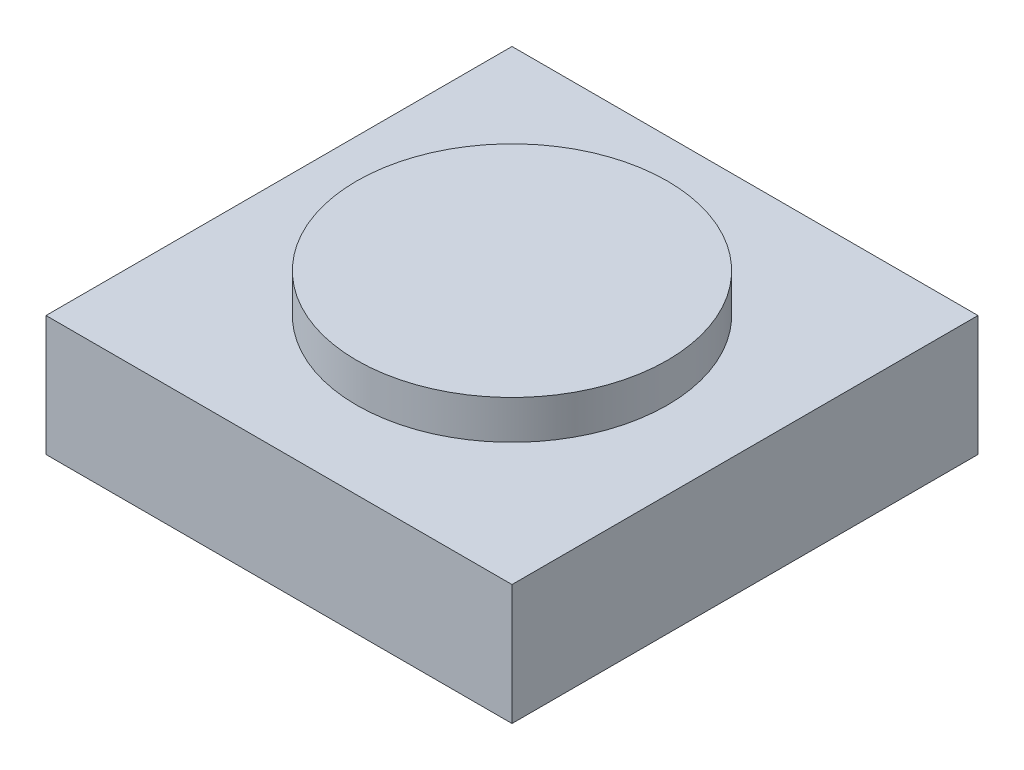
from build123d import *

# Parameters (mm, degrees)
SKETCH_1_W      = 12
SKETCH_1_H      = 12
EXTRUDE_1_DEPTH = 3.1
SKETCH_2_R      = 4
EXTRUDE_2_DEPTH = 1


with BuildPart() as part:
    # 草图1 → 拉伸1 (new body)
    with BuildSketch(Plane(origin=(0, 0, 0), x_dir=(1, 0, 0), z_dir=(0, 1, 0))):
        Rectangle(SKETCH_1_W, SKETCH_1_H)
    extrude(amount=EXTRUDE_1_DEPTH)

    # 草图2 → 拉伸2 (add)
    with BuildSketch(Plane(origin=(0, 3.1, 0), x_dir=(-1, 0, 0), z_dir=(0, 1, 0))):
        with Locations(Location((0, 0, 0), (0, 0, 90))):
            Circle(SKETCH_2_R)
    extrude(amount=EXTRUDE_2_DEPTH)


solid = part.part
